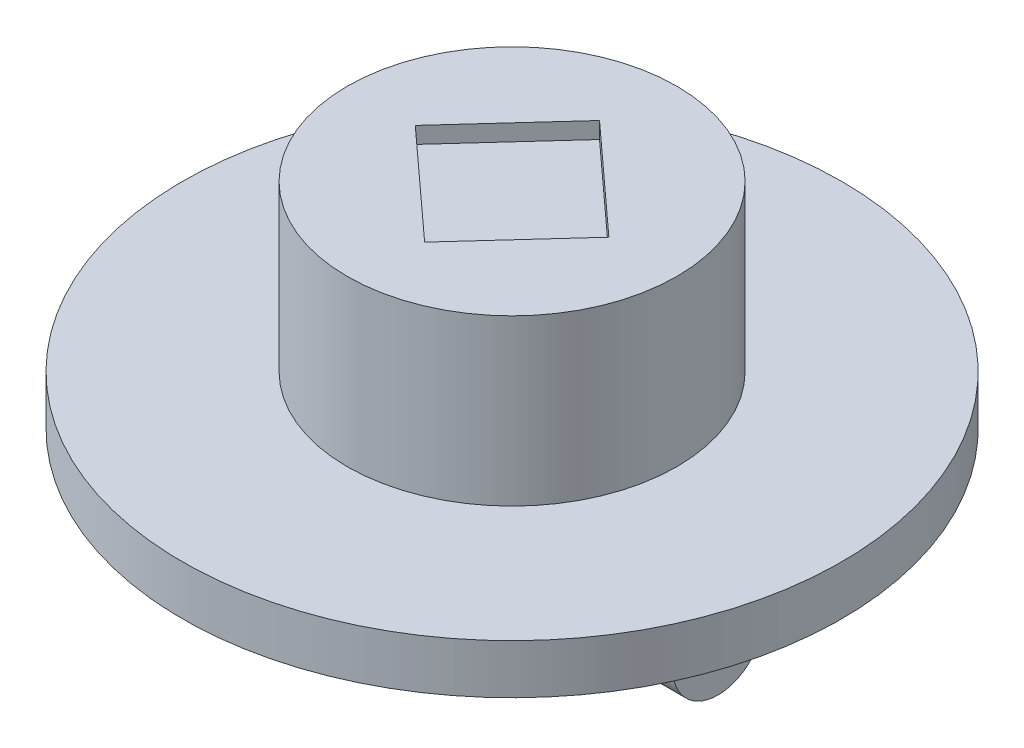
from build123d import *

# Parameters (mm, degrees)
SKETCH1_R           = 50.8
BOSS_EXTRUDE1_DEPTH = 7.62
SKETCH2_W           = 5.08
SKETCH2_H           = 13.97
BOSS_EXTRUDE2_DEPTH = 12.7
SKETCH3_R           = 6.985
BOSS_EXTRUDE3_DEPTH = 5.08
SKETCH4_R           = 2.516115175
CUT_EXTRUDE1_DEPTH  = 5.08
SKETCH5_W           = 5.08
SKETCH5_H           = 13.97
BOSS_EXTRUDE4_DEPTH = 12.7
BOSS_EXTRUDE5_START = -5.08
SKETCH6_R           = 6.985
BOSS_EXTRUDE5_DEPTH = 5.08
SKETCH8_R           = 2.54
CUT_EXTRUDE2_DEPTH  = 5.08
SKETCH9_R           = 25.4
BOSS_EXTRUDE6_DEPTH = 25.4
CUT_EXTRUDE3_DEPTH  = 2.54


with BuildPart() as part:
    # Sketch1 → Boss-Extrude1 (new body)
    with BuildSketch(Plane(origin=(0, 0, 0), x_dir=(1, 0, 0), z_dir=(0, 1, 0))):
        with Locations(Location((0, 0, 0), (0, 0, 90))):
            Circle(SKETCH1_R)
    extrude(amount=BOSS_EXTRUDE1_DEPTH)

    # Sketch2 → Boss-Extrude2 (add)
    with BuildSketch(Plane.XZ):
        with Locations((-29.21, 0)):
            Rectangle(SKETCH2_W, SKETCH2_H)
    extrude(amount=BOSS_EXTRUDE2_DEPTH)

    # Sketch3 → Boss-Extrude3 (add)
    with BuildSketch(Plane.ZY.offset(31.75)):
        with Locations((0, -12.7)):
            Circle(SKETCH3_R)
    extrude(amount=-BOSS_EXTRUDE3_DEPTH)

    # Sketch4 → Cut-Extrude1 (cut)
    with BuildSketch(Plane.ZY.offset(31.75)):
        with Locations((0, -12.7)):
            Circle(SKETCH4_R)
    extrude(amount=-CUT_EXTRUDE1_DEPTH, mode=Mode.SUBTRACT)

    # Sketch5 → Boss-Extrude4 (add)
    with BuildSketch(Plane.XZ):
        with Locations((29.21, 0)):
            Rectangle(SKETCH5_W, SKETCH5_H)
    extrude(amount=BOSS_EXTRUDE4_DEPTH)

    # Sketch6 → Boss-Extrude5 (add)
    with BuildSketch(Plane(origin=(31.75, 0, 0), x_dir=(0, 0, -1), z_dir=(1, 0, 0)).offset(BOSS_EXTRUDE5_START)):
        with Locations((0, -12.7)):
            Circle(SKETCH6_R)
    extrude(amount=BOSS_EXTRUDE5_DEPTH)

    # Sketch8 → Cut-Extrude2 (cut)
    with BuildSketch(Plane(origin=(31.75, 0, 0), x_dir=(0, 0, -1), z_dir=(1, 0, 0))):
        with Locations((0, -12.7)):
            Circle(SKETCH8_R)
    extrude(amount=-CUT_EXTRUDE2_DEPTH, mode=Mode.SUBTRACT)

    # Sketch9 → Boss-Extrude6 (add)
    with BuildSketch(Plane(origin=(0, 7.62, 0), x_dir=(1, 0, 0), z_dir=(0, 1, 0))):
        with Locations(Location((0, 0, 0), (0, 0, 270))):
            Circle(SKETCH9_R)
    extrude(amount=BOSS_EXTRUDE6_DEPTH)

    # Sketch10 → Cut-Extrude3 (cut)
    with BuildSketch(Plane(origin=(0, 33.02, 0), x_dir=(1, 0, 0), z_dir=(0, 1, 0))):
        Polygon((1.37873117, -14.858671092), (-14.9225, 0), (-1.37873117, 14.858671092), (14.9225, 0), align=None)
    extrude(amount=-CUT_EXTRUDE3_DEPTH, mode=Mode.SUBTRACT)


solid = part.part
